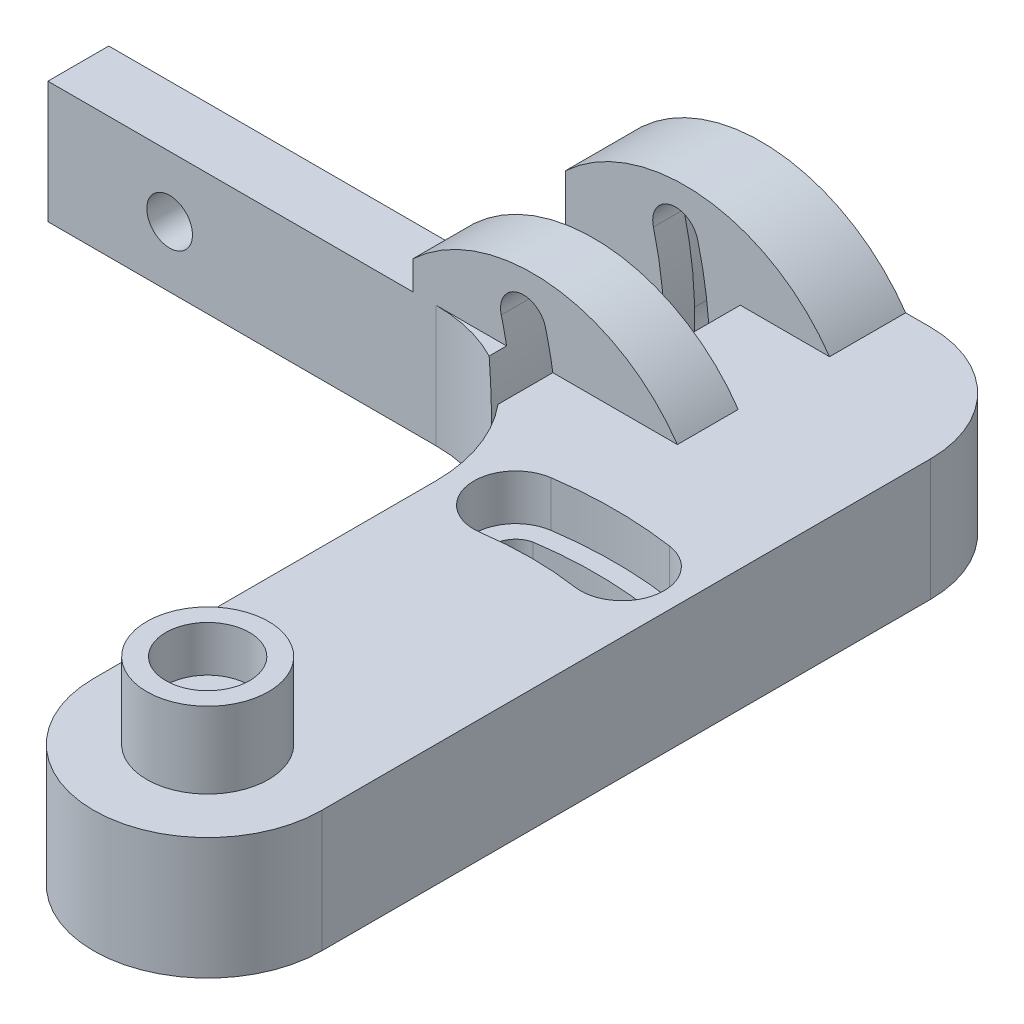
from build123d import *

# Parameters (mm, degrees)
SKETCH1_R           = 1.45
BOSS_EXTRUDE1_DEPTH = 8
SKETCH2_R           = 4
SKETCH2_R_2         = 1.45
BOSS_EXTRUDE2_DEPTH = 2
SKETCH4_R           = 4
SKETCH4_R_2         = 2.75
BOSS_EXTRUDE3_DEPTH = 3
CUT_EXTRUDE1_DEPTH  = 3
CUT_EXTRUDE2_REACH  = 73.014
SKETCH6_R           = 1.5
CUT_EXTRUDE3_DEPTH  = 3
BOSS_EXTRUDE8_DEPTH = 5
BOSS_EXTRUDE9_START = -11
BOSS_EXTRUDE9_DEPTH = 4
CUT_EXTRUDE6_DEPTH  = 72.01408311
SKETCH6_7_R         = 1.5
CUT_EXTRUDE7_DEPTH  = 3


with BuildPart() as part:
    # Sketch1 → Boss-Extrude1 (new body)
    with BuildSketch(Plane(origin=(0, 0, 0), x_dir=(1, 0, 0), z_dir=(0, 1, 0))):
        with BuildLine():
            Line((-7.5, 36.5), (-43, 36.5))
            Line((-43, 36.5), (-43, 32.5))
            Line((-43, 32.5), (-17.5, 32.5))
            ThreePointArc((-17.5, 32.5), (-10.428932188, 29.571067812), (-7.5, 22.5))
            Line((-7.5, 22.5), (-7.5, 0))
            ThreePointArc((-7.5, 0), (0, -7.5), (7.5, 0))
            Line((7.5, 0), (7.5, 40))
            ThreePointArc((7.5, 40), (5.303300859, 45.303300859), (0, 47.5))
            Line((0, 47.5), (-19, 47.5))
            Line((-19, 47.5), (-19, 42.5))
            Line((-19, 42.5), (-7.5, 42.5))
            Line((-7.5, 42.5), (-7.5, 36.5))
        make_face()
        with Locations(Location((0, 0, 0), (0, 0, 270))):
            Circle(SKETCH1_R, mode=Mode.SUBTRACT)
        with BuildLine():
            ThreePointArc((-3.822328563, 25.208378945), (-4.975312132, 23.472395947), (-3.280610142, 22.259550844))
            ThreePointArc((-3.280610142, 22.259550844), (-0.06671842, 22.49990123), (3.148542183, 22.278615056))
            ThreePointArc((3.148542183, 22.278615056), (4.95957959, 23.370856111), (3.89359262, 25.197470135))
            ThreePointArc((3.89359262, 25.197470135), (0.03604708, 25.496495157), (-3.822328563, 25.208378945))
        make_face(mode=Mode.SUBTRACT)
    extrude(amount=BOSS_EXTRUDE1_DEPTH)

    # Sketch2 → Boss-Extrude2 (add)
    with BuildSketch(Plane(origin=(0, 8, 0), x_dir=(1, 0, 0), z_dir=(0, 1, 0))):
        with Locations(Location((0, 0, 0), (0, 0, 270))):
            Circle(SKETCH2_R)
        with Locations(Location((0, 0, 0), (0, 0, 270))):
            Circle(SKETCH2_R_2, mode=Mode.SUBTRACT)
    extrude(amount=BOSS_EXTRUDE2_DEPTH)

    # Sketch4 → Boss-Extrude3 (add)
    with BuildSketch(Plane(origin=(0, 10, 0), x_dir=(1, 0, 0), z_dir=(0, 1, 0))):
        with Locations(Location((0, 0, 0), (0, 0, 270))):
            Circle(SKETCH4_R)
        with Locations(Location((0, 0, 0), (0, 0, 270))):
            Circle(SKETCH4_R_2, mode=Mode.SUBTRACT)
    extrude(amount=BOSS_EXTRUDE3_DEPTH)

    # Sketch5 → Cut-Extrude1 (cut)
    with BuildSketch(Plane(origin=(0, 8, 0), x_dir=(1, 0, 0), z_dir=(0, 1, 0))):
        with BuildLine():
            ThreePointArc((-3.901041667, 26.464020366), (-6.220600225, 23.342378475), (-3.098958333, 21.022819917))
            ThreePointArc((-3.098958333, 21.022819917), (0, 21.25), (3.098958333, 21.022819917))
            ThreePointArc((3.098958333, 21.022819917), (6.220600225, 23.342378475), (3.901041667, 26.464020366))
            ThreePointArc((3.901041667, 26.464020366), (0, 26.75), (-3.901041667, 26.464020366))
        make_face()
    extrude(amount=-CUT_EXTRUDE1_DEPTH, mode=Mode.SUBTRACT)

    # Sketch6 → Cut-Extrude2 (cut, up to next)
    with BuildSketch(Plane(origin=(0, 0, -47.5), x_dir=(-1, 0, 0), z_dir=(0, 0, -1)), mode=Mode.PRIVATE) as cut_extrude2_sk1:
        with Locations((35, 4)):
            Circle(SKETCH6_R)
    cut_extrude2_tool1 = extrude(cut_extrude2_sk1.sketch, amount=-CUT_EXTRUDE2_REACH, mode=Mode.PRIVATE) & part.part
    # Sketch6 → Cut-Extrude2 (cut, up to next)
    with BuildSketch(Plane(origin=(0, 0, -47.5), x_dir=(-1, 0, 0), z_dir=(0, 0, -1)), mode=Mode.PRIVATE) as cut_extrude2_sk2:
        with BuildLine():
            ThreePointArc((13.205467269, 9.590021738), (12.125166536, 11.415658703), (10.299529571, 10.33535797))
            ThreePointArc((10.299529571, 10.33535797), (9.639691668, 6.665475813), (9.522099126, 2.938601373))
            ThreePointArc((9.522099126, 2.938601373), (11.083234391, 1.502336535), (12.519499229, 3.0634718))
            ThreePointArc((12.519499229, 3.0634718), (12.623257354, 6.351890424), (13.205467269, 9.590021738))
        make_face()
    cut_extrude2_tool2 = extrude(cut_extrude2_sk2.sketch, amount=-CUT_EXTRUDE2_REACH, mode=Mode.PRIVATE) & part.part
    add(cut_extrude2_tool1.solids().sort_by_distance((-35, 4, -47.5))[0], mode=Mode.SUBTRACT)
    add(cut_extrude2_tool2.solids().sort_by_distance((-11.259305, 6.495248, -47.5))[0], mode=Mode.SUBTRACT)

    # Sketch6<3> → Cut-Extrude3 (cut)
    with BuildSketch(Plane(origin=(0, 0, -47.5), x_dir=(-1, 0, 0), z_dir=(0, 0, -1))):
        with BuildLine():
            ThreePointArc((9.088722197, 10.645914733), (8.396539299, 6.796136392), (8.273182416, 2.886572028))
            ThreePointArc((8.273182416, 2.886572028), (11.135263735, 0.253419825), (13.768415938, 3.115501144))
            ThreePointArc((13.768415938, 3.115501144), (13.866409723, 6.221229844), (14.416274643, 9.279464975))
            ThreePointArc((14.416274643, 9.279464975), (12.435723299, 12.626466077), (9.088722197, 10.645914733))
        make_face()
        with BuildLine():
            ThreePointArc((10.299529571, 10.33535797), (9.639691668, 6.665475813), (9.522099126, 2.938601373))
            ThreePointArc((9.522099126, 2.938601373), (11.083234391, 1.502336535), (12.519499229, 3.0634718))
            ThreePointArc((12.519499229, 3.0634718), (12.623257354, 6.351890424), (13.205467269, 9.590021738))
            ThreePointArc((13.205467269, 9.590021738), (12.125166536, 11.415658703), (10.299529571, 10.33535797))
        make_face(mode=Mode.SUBTRACT)
    extrude(amount=-CUT_EXTRUDE3_DEPTH, mode=Mode.SUBTRACT)

    # Sketch8 → Boss-Extrude8 (add)
    with BuildSketch(Plane(origin=(0, 0, -47.5), x_dir=(-1, 0, 0), z_dir=(0, 0, -1))):
        with BuildLine():
            Line((19, 8), (19, 9.895699086))
            ThreePointArc((19, 9.895699086), (9.880775279, 12.931961804), (1.631235681, 8))
            Line((1.631235681, 8), (19, 8))
        make_face()
    extrude(amount=-BOSS_EXTRUDE8_DEPTH)

    # Sketch8<3> → Boss-Extrude9 (add)
    with BuildSketch(Plane(origin=(0, 0, -47.5), x_dir=(-1, 0, 0), z_dir=(0, 0, -1)).offset(BOSS_EXTRUDE9_START)):
        with BuildLine():
            Line((19, 8), (19, 9.895699086))
            ThreePointArc((19, 9.895699086), (9.880775279, 12.931961804), (1.631235681, 8))
            Line((1.631235681, 8), (19, 8))
        make_face()
    extrude(amount=-BOSS_EXTRUDE9_DEPTH)

    # Sketch6<6> → Cut-Extrude6 (cut, through all)
    with BuildSketch(Plane(origin=(0, 0, -47.5), x_dir=(-1, 0, 0), z_dir=(0, 0, -1))):
        with BuildLine():
            ThreePointArc((12.519499229, 3.0634718), (12.552838265, 5.541080797), (12.858410175, 8))
            Line((12.858410175, 8), (9.815679481, 8))
            ThreePointArc((9.815679481, 8), (9.542788681, 5.476615002), (9.522099126, 2.938601373))
            ThreePointArc((9.522099126, 2.938601373), (11.083234391, 1.502336535), (12.519499229, 3.0634718))
        make_face()
        with BuildLine():
            ThreePointArc((12.858410175, 8), (13.017557947, 8.798149788), (13.205467269, 9.590021738))
            ThreePointArc((13.205467269, 9.590021738), (12.125166536, 11.415658703), (10.299529571, 10.33535797))
            ThreePointArc((10.299529571, 10.33535797), (10.030287022, 9.17333875), (9.815679481, 8))
            Line((9.815679481, 8), (12.858410175, 8))
        make_face()
    extrude(amount=-CUT_EXTRUDE6_DEPTH, mode=Mode.SUBTRACT)

    # Sketch6<7> → Cut-Extrude7 (cut)
    # profile 1 of 2: a face of its own
    with BuildSketch(Plane(origin=(0, 0, -47.5), x_dir=(-1, 0, 0), z_dir=(0, 0, -1))):
        with Locations((35, 4)):
            Circle(SKETCH6_7_R)
    # profile 2 of 2: a face of its own
    with BuildSketch(Plane(origin=(0, 0, -47.5), x_dir=(-1, 0, 0), z_dir=(0, 0, -1))):
        with BuildLine():
            ThreePointArc((14.416274643, 9.279464975), (13.866409723, 6.221229844), (13.768415938, 3.115501144))
            ThreePointArc((13.768415938, 3.115501144), (11.135263735, 0.253419825), (8.273182416, 2.886572028))
            ThreePointArc((8.273182416, 2.886572028), (8.396539299, 6.796136392), (9.088722197, 10.645914733))
            ThreePointArc((9.088722197, 10.645914733), (12.435723299, 12.626466077), (14.416274643, 9.279464975))
        make_face()
        with BuildLine():
            ThreePointArc((13.205467269, 9.590021738), (12.125166536, 11.415658703), (10.299529571, 10.33535797))
            ThreePointArc((10.299529571, 10.33535797), (9.639691668, 6.665475813), (9.522099126, 2.938601373))
            ThreePointArc((9.522099126, 2.938601373), (11.083234391, 1.502336535), (12.519499229, 3.0634718))
            ThreePointArc((12.519499229, 3.0634718), (12.623257354, 6.351890424), (13.205467269, 9.590021738))
        make_face(mode=Mode.SUBTRACT)
    extrude(amount=-CUT_EXTRUDE7_DEPTH, mode=Mode.SUBTRACT)


solid = part.part
